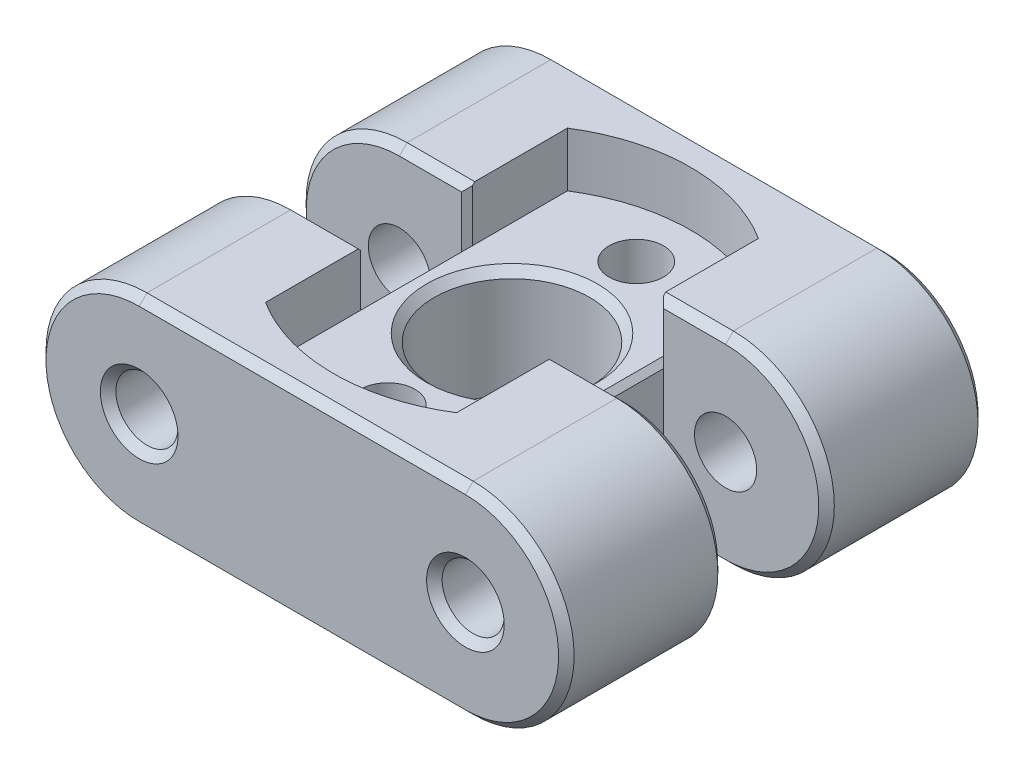
from build123d import *

# Parameters (mm, degrees)
SKETCH1_W           = 21
SKETCH1_H           = 27
BOSS_EXTRUDE1_DEPTH = 13
SKETCH8_R           = 6.5
BOSS_EXTRUDE2_DEPTH = 27
SKETCH2_R           = 5
CUT_EXTRUDE1_DEPTH  = 13
SKETCH3_W           = 21.50173114
SKETCH3_H           = 6.5
CUT_EXTRUDE2_DEPTH  = 13
SKETCH7_W           = 13
SKETCH7_H           = 6.5
CUT_EXTRUDE7_DEPTH  = 3.5
SKETCH4_R           = 2
CUT_EXTRUDE3_DEPTH  = 35
CUT_EXTRUDE4_DEPTH  = 3.5
SKETCH6_R           = 1.75
CUT_EXTRUDE5_DEPTH  = 6
CHAMFER1_SIZE       = 0.5
CHAMFER2_SIZE       = 0.35
CHAMFER3_SIZE       = 0.35
SKETCH9_R           = 10
CUT_EXTRUDE8_DEPTH  = 2.5


with BuildPart() as part:
    # Sketch1 → Boss-Extrude1 (new body)
    with BuildSketch(Plane(origin=(0, 0, 0), x_dir=(1, 0, 0), z_dir=(0, 1, 0))):
        Rectangle(SKETCH1_W, SKETCH1_H)
    extrude(amount=BOSS_EXTRUDE1_DEPTH)

    # Sketch8 → Boss-Extrude2 (add)
    with BuildSketch(Plane(origin=(0, 0, -13.5), x_dir=(-1, 0, 0), z_dir=(0, 0, -1))):
        with Locations((-10.5, 6.5)):
            Circle(SKETCH8_R)
        with Locations((10.5, 6.5)):
            Circle(SKETCH8_R)
    extrude(amount=-BOSS_EXTRUDE2_DEPTH)

    # Sketch2 → Cut-Extrude1 (cut)
    with BuildSketch(Plane(origin=(0, 13, 0), x_dir=(1, 0, 0), z_dir=(0, 1, 0))):
        with Locations(Location((0, 0, 0), (0, 0, 270))):
            Circle(SKETCH2_R)
    extrude(amount=-CUT_EXTRUDE1_DEPTH, mode=Mode.SUBTRACT)

    # Sketch3 → Cut-Extrude2 (cut)
    with BuildSketch(Plane(origin=(0, 13, 0), x_dir=(1, 0, 0), z_dir=(0, 1, 0))):
        with Locations((17.25086557, 0)):
            Rectangle(SKETCH3_W, SKETCH3_H)
        with Locations((-17.25086557, 0)):
            Rectangle(SKETCH3_W, SKETCH3_H)
    extrude(amount=-CUT_EXTRUDE2_DEPTH, mode=Mode.SUBTRACT)

    # Sketch7 → Cut-Extrude7 (cut)
    with BuildSketch(Plane(origin=(0, 13, 0), x_dir=(1, 0, 0), z_dir=(0, 1, 0))):
        Rectangle(SKETCH7_W, SKETCH7_H)
    extrude(amount=-CUT_EXTRUDE7_DEPTH, mode=Mode.SUBTRACT)

    # Sketch4 → Cut-Extrude3 (cut)
    with BuildSketch(Plane.XY.offset(13.5)):
        with Locations((-10.5, 6.5)):
            Circle(SKETCH4_R)
        with Locations((10.5, 6.5)):
            Circle(SKETCH4_R)
    extrude(amount=-CUT_EXTRUDE3_DEPTH, mode=Mode.SUBTRACT)

    # Sketch5 → Cut-Extrude4 (cut)
    with BuildSketch(Plane(origin=(0, 13, 0), x_dir=(1, 0, 0), z_dir=(0, 1, 0))):
        with BuildLine():
            Line((-6.15, 9.717381334), (-6.15, -9.717381334))
            ThreePointArc((-6.15, -9.717381334), (0, -11.5), (6.15, -9.717381334))
            Line((6.15, -9.717381334), (6.15, 9.717381334))
            ThreePointArc((6.15, 9.717381334), (0, 11.5), (-6.15, 9.717381334))
        make_face()
    extrude(amount=-CUT_EXTRUDE4_DEPTH, mode=Mode.SUBTRACT)

    # Sketch6 → Cut-Extrude5 (cut)
    with BuildSketch(Plane(origin=(0, 9.5, 0), x_dir=(1, 0, 0), z_dir=(0, 1, 0))):
        with Locations(Location((0, 8, 0), (0, 0, 270))):
            Circle(SKETCH6_R)
        with Locations(Location((0, -8, 0), (0, 0, 270))):
            Circle(SKETCH6_R)
    extrude(amount=-CUT_EXTRUDE5_DEPTH, mode=Mode.SUBTRACT)

    # Chamfer1
    chamfer1_edges = [part.edges().sort_by_distance(p)[0] for p in [
        (-12.5, 6.5, -13.5),
        (-12.5, 6.5, 13.5),
        (8.5, 6.5, -13.5),
        (8.5, 6.5, 13.5),
        (8.325, 13, 3.25),
        (-8.325, 13, -3.25),
        (17, 6.5, -13.5),
        (17, 6.5, 13.5),
        (0, 13, 13.5),
        (-17, 6.5, -13.5),
        (-17, 6.5, 13.5),
        (0, 0, -5),
        (-17, 6.5, -3.25),
        (-17, 6.5, 3.25),
        (17, 6.5, -3.25),
        (17, 6.5, 3.25),
        (8.5, 0, 3.25),
        (8.5, 0, -3.25),
        (8.325, 13, -3.25),
        (0, 0, 13.5),
        (-8.5, 0, 3.25),
        (-8.5, 0, -3.25),
        (0, 0, -13.5),
        (-8.325, 13, 3.25),
        (0, 9.5, -5),
        (0, 13, -13.5),
    ]]
    chamfer(chamfer1_edges, length=CHAMFER1_SIZE)

    # Chamfer2
    chamfer2_edges = [part.edges().sort_by_distance(p)[0] for p in [
        (6.15, 11, 3.25),
        (6.15, 11, -3.25),
        (-6.15, 11, -3.25),
        (-6.15, 11, 3.25),
    ]]
    chamfer(chamfer2_edges, length=CHAMFER2_SIZE)

    # Chamfer3
    chamfer3_edges = [part.edges().sort_by_distance(p)[0] for p in [
        (6.5, 9.5, 0),
        (-6.5, 9.5, 0),
        (-6.5, 0, 0),
        (6.5, 0, 0),
    ]]
    chamfer(chamfer3_edges, length=CHAMFER3_SIZE)

    # Sketch9 → Cut-Extrude8 (cut)
    with BuildSketch(Plane.XZ):
        Circle(SKETCH9_R)
    extrude(amount=-CUT_EXTRUDE8_DEPTH, mode=Mode.SUBTRACT)


solid = part.part
